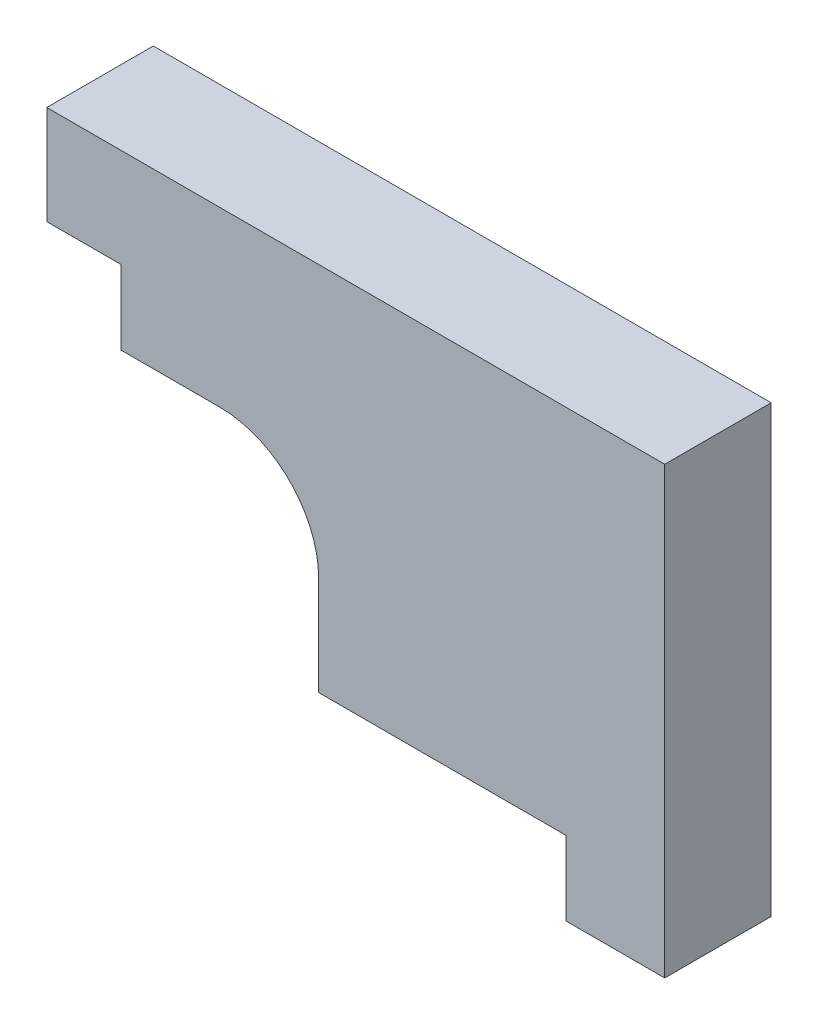
from build123d import *

# Parameters (mm, degrees)
BOSS_EXTRUDE1_DEPTH = 21.542835


with BuildPart() as part:
    # Sketch1 → Boss-Extrude1 (new body)
    with BuildSketch(Plane.XY):
        with BuildLine():
            Line((150, 110), (150, 130))
            ThreePointArc((150, 130), (144.142135624, 144.142135624), (130, 150))
            Line((130, 150), (110, 150))
            Line((110, 150), (110, 165))
            Line((110, 165), (95, 165))
            Line((95, 165), (95, 185))
            Line((95, 185), (220, 185))
            Line((220, 185), (220, 95))
            Line((220, 95), (200, 95))
            Line((200, 95), (200, 110))
            Line((200, 110), (150, 110))
        make_face()
    extrude(amount=-BOSS_EXTRUDE1_DEPTH)


solid = part.part
